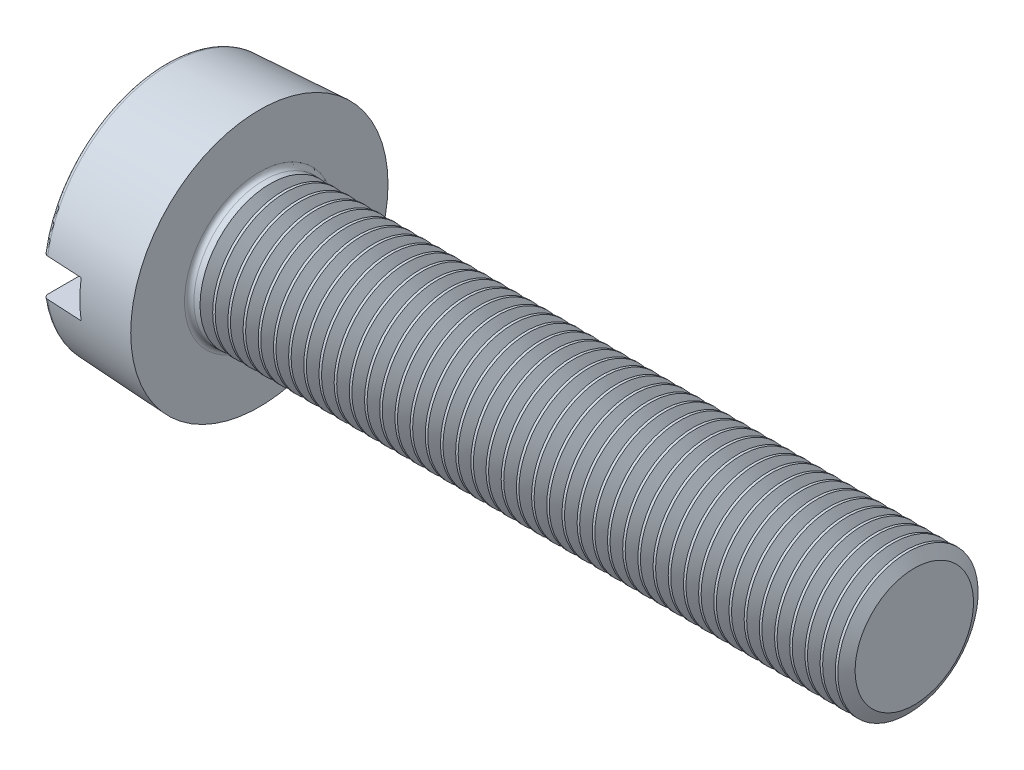
from build123d import *

# Parameters (mm, degrees)
SKETCH2_R        = 2.75
BASEHEAD_DEPTH   = 2
BASEHEAD_DRAFT   = -3
SKETCH3_R        = 1.5
BASEBODY_DEPTH   = 14
SLOT_DEPTH       = 19.69745972
SLOT_DEPTH_BACK  = 19.69745972
SKETCH4_W        = 0.8
SKETCH4_H        = 0.85
HEADFILLET_R     = 0.1
LPATTERN10_COUNT = 43
LPATTERN10_PITCH = 0.3246


with BuildPart() as part:
    # Sketch2 → BaseHead (with draft: the straight prism first)
    with BuildSketch(Plane(origin=(2, 0, 0), x_dir=(0, 0, -1), z_dir=(1, 0, 0))):
        Circle(SKETCH2_R)
    extrude(amount=-BASEHEAD_DEPTH)
    # BaseHead: the draft: its side faces are tilted about the plane it starts from
    basehead_sides = [part.faces().sort_by_distance(p)[0] for p in [
        (1, 0, 2.75),
    ]]
    draft(basehead_sides, Plane(origin=(2, 0, 0), x_dir=(0, 0, -1), z_dir=(1, 0, 0)), BASEHEAD_DRAFT)

    # Sketch3 → BaseBody (add)
    with BuildSketch(Plane(origin=(2, -1.110095321, -1.354392991), x_dir=(0, 0, -1), z_dir=(1, 0, 0))):
        with Locations((-1.354392991, 1.110095321)):
            Circle(SKETCH3_R)
    extrude(amount=BASEBODY_DEPTH)

    # Sketch4 → Slot (cut, two sides: drawn at the far end of the back side and taken through both)
    with BuildSketch(Plane(origin=(-1.9, -1.9, 0), x_dir=(0, 1, 0), z_dir=(0, 0, 1)).offset(-SLOT_DEPTH_BACK)):
        with Locations((1.9, -2.325)):
            Rectangle(SKETCH4_W, SKETCH4_H)
    extrude(amount=SLOT_DEPTH + SLOT_DEPTH_BACK, mode=Mode.SUBTRACT)

    # HeadFillet
    headfillet_edges = [part.edges().sort_by_distance(p)[0] for p in [
        (2, 0, 1.5),
        (0, -2.645184441, 0),
        (0, 2.645184441, 0),
    ]]
    fillet(headfillet_edges, radius=HEADFILLET_R)

    # Sketch5 → Cut-Revolve10 (revolve, cut)
    with BuildSketch(Plane.XY, mode=Mode.PRIVATE) as cut_revolve10_sk:
        Polygon((16.13525, 1.5), (16.13525, 1.7705), (15.86475, 1.7705), (15.86475, 1.5), (16, 1.265740128), align=None)
    cut_revolve10 = revolve(cut_revolve10_sk.sketch.rotate(Axis((0, 0, 0), (1, 0, 0)), 90), axis=Axis((0, 0, 0), (1, 0, 0)), mode=Mode.SUBTRACT)

    # LPattern10: Cut-Revolve10 ×43
    with Locations(*[(-i * LPATTERN10_PITCH, 0, 0) for i in range(1, LPATTERN10_COUNT)]):
        add(cut_revolve10, mode=Mode.SUBTRACT)


solid = part.part
